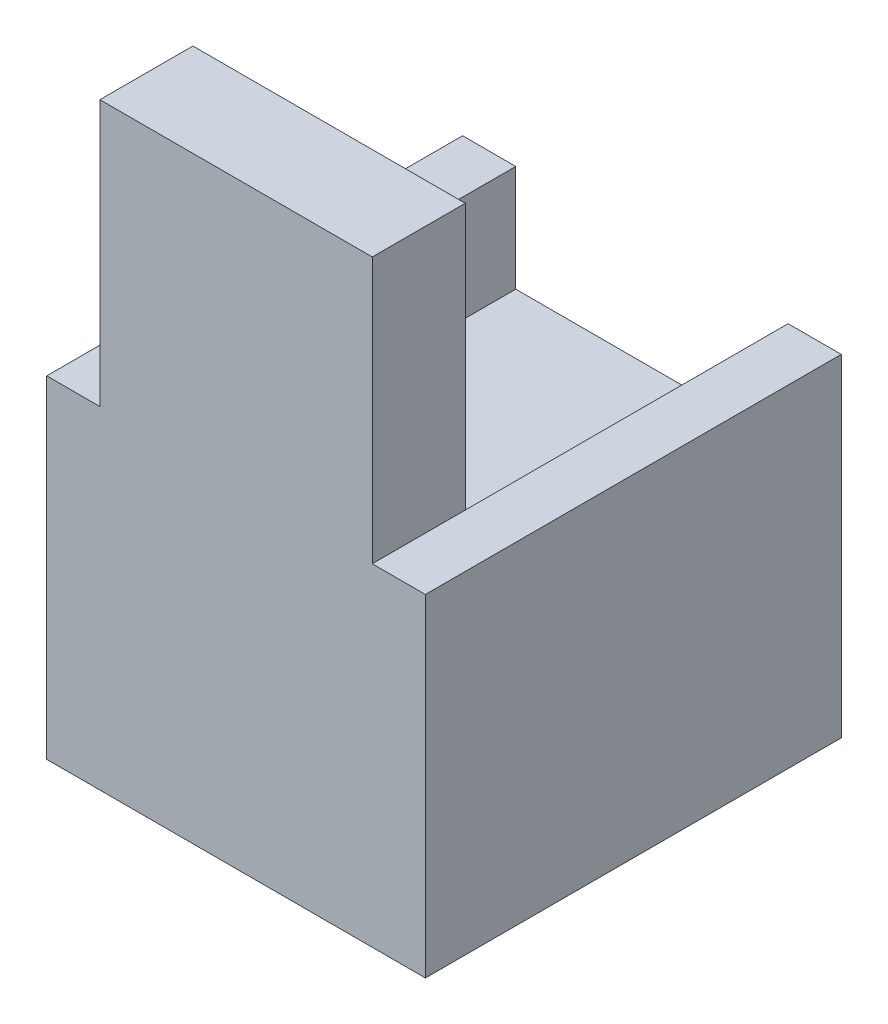
from build123d import *

# Parameters (mm, degrees)
SKETCH1_W           = 723.9
SKETCH1_H           = 795.02
BOSS_EXTRUDE1_DEPTH = 431.8
SKETCH2_W           = 101.6
SKETCH2_H           = 795.02
BOSS_EXTRUDE2_DEPTH = 203.2
SKETCH3_W           = 520.7
SKETCH3_H           = 177.8
BOSS_EXTRUDE3_DEPTH = 711.2


with BuildPart() as part:
    # Sketch1 → Boss-Extrude1 (new body)
    with BuildSketch(Plane(origin=(0, 0, 0), x_dir=(1, 0, 0), z_dir=(0, 1, 0))):
        with Locations((-33.853948498, -397.51)):
            Rectangle(SKETCH1_W, SKETCH1_H)
    extrude(amount=BOSS_EXTRUDE1_DEPTH)

    # Sketch2 → Boss-Extrude2 (add)
    with BuildSketch(Plane(origin=(0, 431.8, 0), x_dir=(1, 0, 0), z_dir=(0, 1, 0))):
        with Locations((-345.003948498, -397.51)):
            Rectangle(SKETCH2_W, SKETCH2_H)
        with Locations((277.296051502, -397.51)):
            Rectangle(SKETCH2_W, SKETCH2_H)
    extrude(amount=BOSS_EXTRUDE2_DEPTH)

    # Sketch3 → Boss-Extrude3 (add)
    with BuildSketch(Plane(origin=(0, 431.8, 0), x_dir=(1, 0, 0), z_dir=(0, 1, 0))):
        with Locations((-33.853948498, -706.12)):
            Rectangle(SKETCH3_W, SKETCH3_H)
    extrude(amount=BOSS_EXTRUDE3_DEPTH)


solid = part.part
